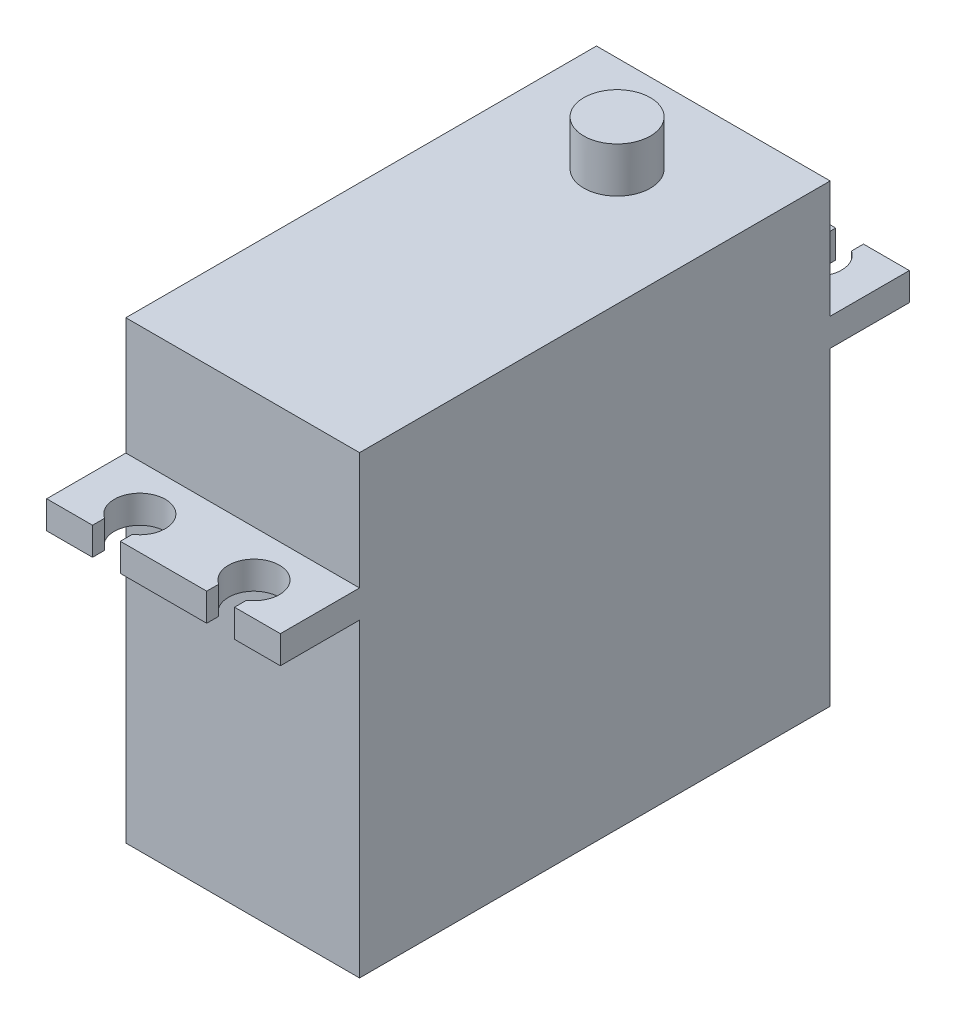
from build123d import *

# Parameters (mm, degrees)
SKETCH1_W           = 40.6
SKETCH1_H           = 39.25
BOSS_EXTRUDE1_DEPTH = 10.08
BOSS_EXTRUDE2_DEPTH = 2.4
SKETCH3_W           = 6.4
SKETCH3_H           = 4.1
BOSS_EXTRUDE3_DEPTH = 6
SKETCH4_R           = 2.87
BOSS_EXTRUDE4_DEPTH = 3.9


with BuildPart() as part:
    # Sketch1 → Boss-Extrude1 (new, symmetric)
    with BuildSketch(Plane(origin=(0, 0, 0), x_dir=(0, 0, -1), z_dir=(1, 0, 0))):
        with Locations((0, 19.625)):
            Rectangle(SKETCH1_W, SKETCH1_H)
    extrude(amount=BOSS_EXTRUDE1_DEPTH, both=True)

    # Sketch2 → Boss-Extrude2 (add)
    with BuildSketch(Plane(origin=(0, 29.14, 0), x_dir=(1, 0, 0), z_dir=(0, 1, 0))):
        with BuildLine():
            Line((-10.08, -20.3), (10.08, -20.3))
            Line((10.08, -20.3), (10.08, -27.13))
            Line((10.08, -27.13), (6.124613606, -27.13))
            Line((6.124613606, -27.13), (6.124613606, -26.094160296))
            ThreePointArc((6.124613606, -26.094160296), (4.925, -22.05), (3.725386394, -26.094160296))
            Line((3.725386394, -26.094160296), (3.725386394, -27.13))
            Line((3.725386394, -27.13), (-3.725386394, -27.13))
            Line((-3.725386394, -27.13), (-3.725386394, -26.094160296))
            ThreePointArc((-3.725386394, -26.094160296), (-4.925, -22.05), (-6.124613606, -26.094160296))
            Line((-6.124613606, -26.094160296), (-6.124613606, -27.13))
            Line((-6.124613606, -27.13), (-10.08, -27.13))
            Line((-10.08, -27.13), (-10.08, -20.3))
        make_face()
    boss_extrude2 = extrude(amount=-BOSS_EXTRUDE2_DEPTH)

    # Mirror1: Boss-Extrude2 across plane
    add(boss_extrude2.mirror(Plane.XY))

    # Sketch3 → Boss-Extrude3 (add)
    with BuildSketch(Plane(origin=(0, 0, -20.3), x_dir=(-1, 0, 0), z_dir=(0, 0, -1))):
        with Locations((0, 5.524349408)):
            Rectangle(SKETCH3_W, SKETCH3_H)
    extrude(amount=BOSS_EXTRUDE3_DEPTH)

    # Sketch4 → Boss-Extrude4 (add)
    with BuildSketch(Plane(origin=(0, 39.25, 0), x_dir=(1, 0, 0), z_dir=(0, 1, 0))):
        with Locations(Location((0, 12, 0), (0, 0, 90))):
            Circle(SKETCH4_R)
    extrude(amount=BOSS_EXTRUDE4_DEPTH)


solid = part.part
